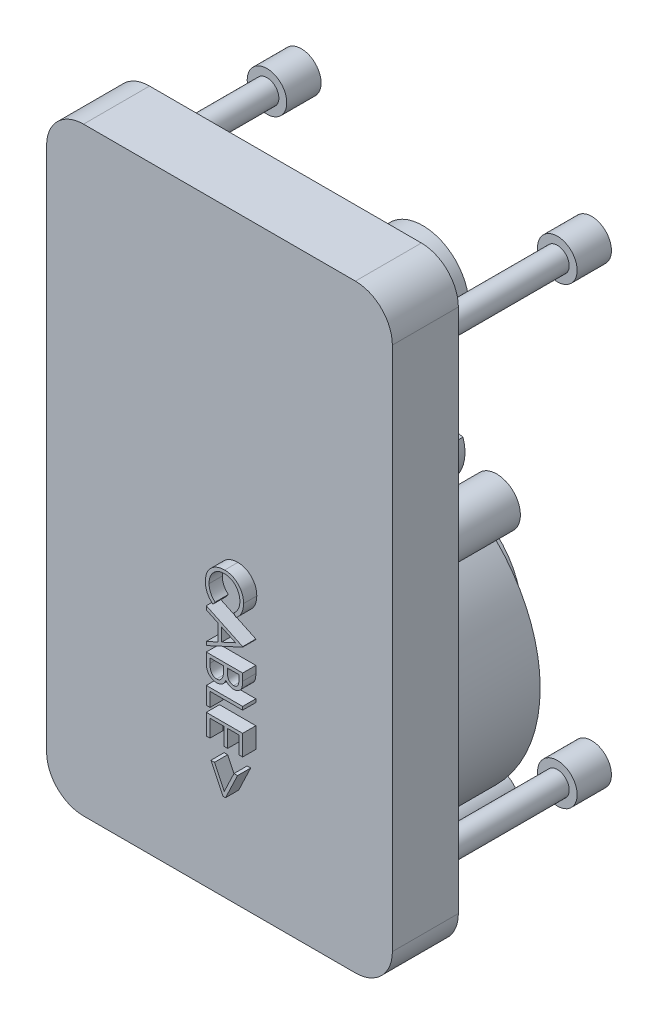
from build123d import *
from build123d.topology import SkipClean

# Parameters (mm, degrees)
SKETCH1_R             = 7.239
BOSS_EXTRUDE1_DEPTH   = 10.16
SKETCH2_R             = 6.35
BOSS_EXTRUDE2_DEPTH   = 1.778
SKETCH3_R             = 2.286
BOSS_EXTRUDE3_DEPTH   = 1.27
BOSS_EXTRUDE4_DEPTH   = 3.302
SKETCH5_R             = 4.445
BOSS_EXTRUDE5_DEPTH   = 11.43
SKETCH6_R             = 1.143
BOSS_EXTRUDE6_DEPTH   = 15.494
BOSS_EXTRUDE6_2_DEPTH = 15.494
BOSS_EXTRUDE6_3_DEPTH = 15.494
BOSS_EXTRUDE6_4_DEPTH = 15.494
SKETCH7_R             = 7.239
BOSS_EXTRUDE7_DEPTH   = 5.334
BOSS_EXTRUDE8_DEPTH   = 6.35
SKETCH9_R             = 1.905
BOSS_EXTRUDE9_DEPTH   = 3.302
BOSS_EXTRUDE10_DEPTH  = 1.27


with BuildPart() as part:
    # Sketch1 → Boss-Extrude1 (new body)
    # profile 1 of 7: a face of its own
    with BuildSketch(Plane.XY):
        with BuildLine():
            ThreePointArc((10.064128852, -22.930567504), (13.235964532, -18.24620987), (14.351, -12.7))
            ThreePointArc((14.351, -12.7), (13.235964532, -7.15379013), (10.064128852, -2.469432496))
            ThreePointArc((10.064128852, -2.469432496), (8.455209632, -1.104283934), (6.663505747, 0.010188518))
            ThreePointArc((6.663505747, 0.010188518), (5.175517983, 0.685261096), (3.62043784, 1.186815))
            ThreePointArc((3.62043784, 1.186815), (0, -3.81), (-3.62043784, 1.186815))
            ThreePointArc((-3.62043784, 1.186815), (-5.175517983, 0.685261096), (-6.663505747, 0.010188518))
            ThreePointArc((-6.663505747, 0.010188518), (-8.455209632, -1.104283934), (-10.064128852, -2.469432496))
            ThreePointArc((-10.064128852, -2.469432496), (-14.351, -12.7), (-10.064128852, -22.930567504))
            ThreePointArc((-10.064128852, -22.930567504), (-8.455209632, -24.295716066), (-6.663505747, -25.410188518))
            ThreePointArc((-6.663505747, -25.410188518), (0, -27.051), (6.663505747, -25.410188518))
            ThreePointArc((6.663505747, -25.410188518), (8.455209632, -24.295716066), (10.064128852, -22.930567504))
        make_face()
        with Locations((0, -12.7)):
            Circle(SKETCH1_R, mode=Mode.SUBTRACT)
    # profile 2 of 7: a face of its own
    with BuildSketch(Plane.XY):
        with BuildLine():
            ThreePointArc((-10.064128852, -2.469432496), (-8.455209632, -1.104283934), (-6.663505747, 0.010188518))
            ThreePointArc((-6.663505747, 0.010188518), (-10.236847552, 1.339105214), (-10.064128852, -2.469432496))
        make_face()
    # profile 3 of 7: a face of its own
    with BuildSketch(Plane.XY):
        with BuildLine():
            ThreePointArc((-3.62043784, 1.186815), (0, -3.81), (3.62043784, 1.186815))
            ThreePointArc((3.62043784, 1.186815), (0, 1.651), (-3.62043784, 1.186815))
        make_face()
    # profile 4 of 7: a face of its own
    with BuildSketch(Plane.XY):
        with BuildLine():
            ThreePointArc((6.663505747, 0.010188518), (8.455209632, -1.104283934), (10.064128852, -2.469432496))
            ThreePointArc((10.064128852, -2.469432496), (10.236847552, 1.339105214), (6.663505747, 0.010188518))
        make_face()
    # profile 5 of 7: a face of its own
    with BuildSketch(Plane.XY):
        with BuildLine():
            ThreePointArc((6.663505747, -25.410188518), (10.236847552, -26.739105214), (10.064128852, -22.930567504))
            ThreePointArc((10.064128852, -22.930567504), (8.455209632, -24.295716066), (6.663505747, -25.410188518))
        make_face()
    # profile 6 of 7: a face of its own
    with BuildSketch(Plane.XY):
        with BuildLine():
            ThreePointArc((-10.064128852, -22.930567504), (-10.236847552, -26.739105214), (-6.663505747, -25.410188518))
            ThreePointArc((-6.663505747, -25.410188518), (-8.455209632, -24.295716066), (-10.064128852, -22.930567504))
        make_face()
    # profile 7 of 7: a face of its own
    with BuildSketch(Plane.XY):
        with Locations((0, -12.7)):
            Circle(SKETCH1_R)
    extrude(amount=-BOSS_EXTRUDE1_DEPTH)

    # Sketch3 → Boss-Extrude3 (add)
    with SkipClean():  # the faces are left unmerged after this step: merging them gives an invalid solid
        with BuildSketch(Plane(origin=(0, 0, -10.16), x_dir=(-1, 0, 0), z_dir=(0, 0, -1))):
            with Locations(Location((-8.89, -0.508, 0), (0, 0, 239.094930529))):
                Circle(SKETCH3_R)
            with Locations(Location((8.89, -24.892, 0), (0, 0, 193.101637405))):
                Circle(SKETCH3_R)
            with Locations(Location((-8.89, -24.892, 0), (0, 0, 120.905069471))):
                Circle(SKETCH3_R)
            with Locations(Location((8.89, -0.508, 0), (0, 0, 166.898362595))):
                Circle(SKETCH3_R)
        extrude(amount=BOSS_EXTRUDE3_DEPTH)

    # Sketch4 → Boss-Extrude4 (add)
    with SkipClean():  # the faces are left unmerged after this step: merging them gives an invalid solid
        with BuildSketch(Plane(origin=(0, 0, -10.16), x_dir=(-1, 0, 0), z_dir=(0, 0, -1))):
            with BuildLine():
                ThreePointArc((-3.62043784, 1.186815), (0, -3.81), (3.62043784, 1.186815))
                ThreePointArc((3.62043784, 1.186815), (0, 1.651), (-3.62043784, 1.186815))
            make_face()
        extrude(amount=BOSS_EXTRUDE4_DEPTH)

    # Sketch7 → Boss-Extrude7 (add)
    with SkipClean():  # the faces are left unmerged after this step: merging them gives an invalid solid
        with BuildSketch(Plane(origin=(0, 0, -10.16), x_dir=(-1, 0, 0), z_dir=(0, 0, -1))):
            with Locations(Location((0, -12.7, 0), (0, 0, 180))):
                Circle(SKETCH7_R)
        extrude(amount=BOSS_EXTRUDE7_DEPTH)



with BuildPart() as body_2:
    # Sketch2 → Boss-Extrude2 (new body)
    with BuildSketch(Plane.XY):
        with Locations((0, 14.605)):
            Circle(SKETCH2_R)
    extrude(amount=-BOSS_EXTRUDE2_DEPTH)

    # Sketch5 → Boss-Extrude5 (add)
    with BuildSketch(Plane(origin=(0, 0, -1.778), x_dir=(-1, 0, 0), z_dir=(0, 0, -1))):
        with Locations(Location((0, 12.7, 0), (0, 0, 269.999298311))):
            Circle(SKETCH5_R)
    extrude(amount=BOSS_EXTRUDE5_DEPTH)


with BuildPart() as body_3:
    # Sketch6 → Boss-Extrude6 (new body)
    with BuildSketch(Plane.XY):
        with Locations((-13.97, 21.844)):
            Circle(SKETCH6_R)
    extrude(amount=-BOSS_EXTRUDE6_DEPTH)


with BuildPart() as body_4:
    # Sketch6 → Boss-Extrude6 2 (new body)
    with BuildSketch(Plane.XY):
        with Locations((13.97, 21.844)):
            Circle(SKETCH6_R)
    extrude(amount=-BOSS_EXTRUDE6_2_DEPTH)


with BuildPart() as body_5:
    # Sketch6 → Boss-Extrude6 3 (new body)
    with BuildSketch(Plane.XY):
        with Locations((-13.97, -21.844)):
            Circle(SKETCH6_R)
    extrude(amount=-BOSS_EXTRUDE6_3_DEPTH)


with BuildPart() as body_6:
    # Sketch6 → Boss-Extrude6 4 (new body)
    with BuildSketch(Plane.XY):
        with Locations((13.97, -21.844)):
            Circle(SKETCH6_R)
    extrude(amount=-BOSS_EXTRUDE6_4_DEPTH)


with BuildPart() as part_1:
    with SkipClean():  # the faces are left unmerged after this step: merging them gives an invalid solid
        add(part.part)

        add(body_2.part)  # Boss-Extrude8 merges body 2

        add(body_3.part)  # Boss-Extrude8 merges body 3

        add(body_4.part)  # Boss-Extrude8 merges body 4

        add(body_5.part)  # Boss-Extrude8 merges body 5

        add(body_6.part)  # Boss-Extrude8 merges body 6
        # Sketch8 → Boss-Extrude8 (add)
        with BuildSketch(Plane.XY):
            with BuildLine():
                Line((-13.081, 28.829), (13.081, 28.829))
                ThreePointArc((13.081, 28.829), (15.595471714, 27.787471714), (16.637, 25.273))
                Line((16.637, 25.273), (16.637, -25.273))
                ThreePointArc((16.637, -25.273), (15.595471714, -27.787471714), (13.081, -28.829))
                Line((13.081, -28.829), (-13.081, -28.829))
                ThreePointArc((-13.081, -28.829), (-15.595471714, -27.787471714), (-16.637, -25.273))
                Line((-16.637, -25.273), (-16.637, 25.273))
                ThreePointArc((-16.637, 25.273), (-15.595471714, 27.787471714), (-13.081, 28.829))
            make_face()
        extrude(amount=BOSS_EXTRUDE8_DEPTH)

    # Sketch9 → Boss-Extrude9 (add)
    with SkipClean():  # the faces are left unmerged after this step: merging them gives an invalid solid
        with BuildSketch(Plane(origin=(0, 0, -15.494), x_dir=(-1, 0, 0), z_dir=(0, 0, -1))):
            with Locations((-13.97, 21.844)):
                Circle(SKETCH9_R)
            with Locations((13.97, 21.844)):
                Circle(SKETCH9_R)
            with Locations((13.97, -21.844)):
                Circle(SKETCH9_R)
            with Locations((-13.97, -21.844)):
                Circle(SKETCH9_R)
        extrude(amount=-BOSS_EXTRUDE9_DEPTH)

    # Sketch10 → Boss-Extrude10 (add)
    # profile 1 of 6: a face of its own
    with SkipClean():  # the faces are left unmerged after this step: merging them gives an invalid solid
        with BuildSketch(Plane.XY.offset(6.35)):
            with BuildLine():
                Line((2.857772436, -3.679487179), (2.647435897, -3.404647436))
                add(Edge.make_bspline(
                    [(2.647435897, -3.404647436), (2.670801867, -3.385041548), (2.717218783, -3.346094101), (2.782398327, -3.283434898), (2.843463589, -3.218133255), (2.900705469, -3.150214134), (2.952122234, -3.078455015), (3.000393337, -3.004594216), (3.043661075, -2.927396171), (3.096124061, -2.820644436), (3.150870216, -2.680996588), (3.196773448, -2.505201749), (3.225994623, -2.32169065), (3.229159465, -2.196493051), (3.230769231, -2.1328125)],
                    knots=[0, 0, 0, 0, 0.757959112, 1.505699292, 2.245454638, 2.979532153, 3.711538275, 4.438200793, 5.171680507, 5.909471876, 7.393775596, 8.890124382, 10.418191784, 12, 12, 12, 12], degree=3))
                add(Edge.make_bspline(
                    [(3.230769231, -2.1328125), (3.230363445, -2.097729627), (3.229555641, -2.027889483), (3.218973416, -1.924234716), (3.20392868, -1.822319184), (3.1821483, -1.722521872), (3.153792222, -1.625040935), (3.120538112, -1.529134135), (3.079156746, -1.435930999), (3.033456552, -1.34430985), (2.981823731, -1.256534692), (2.925523467, -1.173466714), (2.865108338, -1.095485416), (2.800734294, -1.02237471), (2.731601295, -0.954936411), (2.658522608, -0.892089722), (2.580618642, -0.834967287), (2.499350418, -0.782165421), (2.41459849, -0.735181205), (2.326896016, -0.694608059), (2.236578315, -0.6598335), (2.143460367, -0.632062149), (2.047908611, -0.610157149), (1.949720267, -0.59502418), (1.849085923, -0.584537152), (1.780876701, -0.583736779), (1.746494391, -0.583333333)],
                    knots=[0, 0, 0, 0, 1.055000685, 2.100209969, 3.131349012, 4.153242145, 5.170189196, 6.184191144, 7.204341339, 8.235672124, 9.263040994, 10.265373269, 11.252624173, 12.22887325, 13.193405896, 14.155809299, 15.126090485, 16.097288279, 17.069732292, 18.038585918, 19.002221264, 19.978698174, 20.959418239, 21.948869816, 22.966084182, 24, 24, 24, 24], degree=3))
                add(Edge.make_bspline(
                    [(1.746494391, -0.583333333), (1.694763071, -0.584595152), (1.593195486, -0.587072567), (1.444424876, -0.609120901), (1.301904202, -0.642625992), (1.16652436, -0.692841569), (1.036616002, -0.75476062), (0.914377148, -0.833001231), (0.797960584, -0.923617768), (0.690117636, -1.027892188), (0.591603911, -1.142298004), (0.504853329, -1.265045915), (0.432538447, -1.395830203), (0.3723625, -1.533206833), (0.326105772, -1.678232947), (0.293541649, -1.83064775), (0.272299468, -1.990119745), (0.27026578, -2.099089145), (0.269230769, -2.154547276)],
                    knots=[0, 0, 0, 0, 1.029171465, 2.020641659, 2.987623507, 3.938342917, 4.889210282, 5.84687017, 6.821220943, 7.821438502, 8.827599549, 9.822697543, 10.807740252, 11.797342354, 12.80366471, 13.83203677, 14.896651826, 16, 16, 16, 16], degree=3))
                add(Edge.make_bspline(
                    [(0.269230769, -2.154547276), (0.270919549, -2.215649965), (0.274243472, -2.335914674), (0.302402721, -2.5122827), (0.348060638, -2.681118466), (0.411958561, -2.842431052), (0.495023849, -2.995765698), (0.595721726, -3.141362359), (0.715010059, -3.279343929), (0.806093187, -3.362315211), (0.852564103, -3.404647436)],
                    knots=[0, 0, 0, 0, 1.028121516, 2.023589091, 2.998037872, 3.967518031, 4.937445131, 5.927275754, 6.942489185, 8, 8, 8, 8], degree=3))
                Line((0.852564103, -3.404647436), (0.644330929, -3.679487179))
                add(Edge.make_bspline(
                    [(0.644330929, -3.679487179), (0.615792429, -3.657369099), (0.558852125, -3.613238882), (0.478581139, -3.54178043), (0.403074401, -3.466504759), (0.332956835, -3.386842997), (0.266764666, -3.303747898), (0.206716932, -3.215755784), (0.150984484, -3.12438645), (0.100628049, -3.02910793), (0.05547798, -2.930233036), (0.017361042, -2.827864665), (-0.015946051, -2.722870088), (-0.04316627, -2.615196429), (-0.064445988, -2.50448398), (-0.078663293, -2.391112597), (-0.088405847, -2.274842967), (-0.089293675, -2.196401513), (-0.08974359, -2.156650641)],
                    knots=[0, 0, 0, 0, 0.986756325, 1.968786143, 2.935506311, 3.899499537, 4.868307269, 5.8376204, 6.809456583, 7.792545619, 8.781780509, 9.778496008, 10.776623214, 11.79151764, 12.812666265, 13.856269958, 14.913646641, 16, 16, 16, 16], degree=3))
                add(Edge.make_bspline(
                    [(-0.08974359, -2.156650641), (-0.089481597, -2.119006974), (-0.088963539, -2.044571284), (-0.080571372, -1.934672532), (-0.069121635, -1.827682951), (-0.051881504, -1.723908326), (-0.031537164, -1.622782351), (-0.004265907, -1.525221766), (0.026283259, -1.430266556), (0.062188246, -1.338298215), (0.102704429, -1.249238515), (0.148495987, -1.163374704), (0.199177852, -1.080746271), (0.253632863, -1.000540851), (0.313610164, -0.923943267), (0.378276799, -0.850289742), (0.44741481, -0.779167265), (0.497269663, -0.73516458), (0.522335737, -0.713040865)],
                    knots=[0, 0, 0, 0, 1.114604814, 2.203992996, 3.262667896, 4.300477797, 5.318619304, 6.316056647, 7.298880507, 8.271930387, 9.238335007, 10.195173496, 11.151986948, 12.108099108, 13.064862484, 14.031167946, 15.010108607, 16, 16, 16, 16], degree=3))
                add(Edge.make_bspline(
                    [(0.522335737, -0.713040865), (0.565876926, -0.677605222), (0.652433637, -0.607161745), (0.792719618, -0.517036062), (0.939187827, -0.439888506), (1.092607755, -0.377512586), (1.252635143, -0.328749852), (1.419350657, -0.294968657), (1.592598599, -0.273017053), (1.710435388, -0.270506764), (1.770332532, -0.269230769)],
                    knots=[0, 0, 0, 0, 0.994628077, 1.977248131, 2.950237994, 3.925870899, 4.908910175, 5.911660606, 6.938484602, 8, 8, 8, 8], degree=3))
                add(Edge.make_bspline(
                    [(1.770332532, -0.269230769), (1.833285352, -0.270792919), (1.957141094, -0.27386635), (2.138952641, -0.299762866), (2.312890308, -0.341927395), (2.479623367, -0.399988234), (2.638197835, -0.476586004), (2.789283438, -0.569313798), (2.93275681, -0.679077345), (3.066783632, -0.804498118), (3.18931972, -0.9420727), (3.297126777, -1.089389619), (3.386844068, -1.246172066), (3.461840291, -1.410689784), (3.519484737, -1.584175502), (3.559837929, -1.766258861), (3.584955044, -1.956597778), (3.588130252, -2.086460203), (3.58974359, -2.15244391)],
                    knots=[0, 0, 0, 0, 1.032901378, 2.032168977, 3.007206631, 3.966850309, 4.924221947, 5.891988639, 6.871730993, 7.884084801, 8.900290346, 9.89161143, 10.874607481, 11.860025555, 12.854717796, 13.869097222, 14.917278314, 16, 16, 16, 16], degree=3))
                add(Edge.make_bspline(
                    [(3.58974359, -2.15244391), (3.589261812, -2.192658461), (3.588308181, -2.272259114), (3.578996816, -2.390010625), (3.563502411, -2.50465715), (3.542274027, -2.616475949), (3.516255146, -2.725872498), (3.482194419, -2.83172447), (3.442641565, -2.934608269), (3.39824916, -3.03460095), (3.347498469, -3.130614623), (3.292377899, -3.222631813), (3.231615083, -3.309542503), (3.167218841, -3.392981488), (3.096780331, -3.471070292), (3.022593437, -3.546039113), (2.942456775, -3.615298244), (2.886052222, -3.658051701), (2.857772436, -3.679487179)],
                    knots=[0, 0, 0, 0, 1.096705196, 2.170817488, 3.219277236, 4.250701065, 5.274195539, 6.284202015, 7.28098643, 8.279664616, 9.266225751, 10.241373748, 11.203306326, 12.157093976, 13.114198862, 14.069774147, 15.032234603, 16, 16, 16, 16], degree=3))
            make_face()
        # profile 2 of 6: a face of its own
        with BuildSketch(Plane.XY.offset(6.35)):
            Polygon((3.5, -5.833333333), (0, -7.448717949), (0, -7.107271635), (1.121794872, -6.58984375), (1.121794872, -5.003205128), (0, -4.471053686), (0, -4.128205128), (3.5, -5.788461538), align=None)
            Polygon((2.817808494, -5.807391827), (1.480769231, -5.173577724), (1.480769231, -6.424379006), align=None, mode=Mode.SUBTRACT)
        # profile 3 of 6: a face of its own
        with BuildSketch(Plane.XY.offset(6.35)):
            with BuildLine():
                Line((3.5, -7.987179487), (3.5, -8.670072115))
                add(Edge.make_bspline(
                    [(3.5, -8.670072115), (3.49982425, -8.703500594), (3.499483602, -8.768293304), (3.49420047, -8.862512746), (3.486996801, -8.950761556), (3.475566708, -9.033065329), (3.461774931, -9.109386031), (3.445073115, -9.179953668), (3.425046501, -9.244543841), (3.39320022, -9.321656577), (3.345877051, -9.409577238), (3.275948486, -9.504775631), (3.190416023, -9.58617987), (3.093933368, -9.656366187), (2.987797596, -9.712167307), (2.874538407, -9.752536604), (2.755616665, -9.778094479), (2.673973487, -9.780722914), (2.63271234, -9.782051282)],
                    knots=[0, 0, 0, 0, 1.001505555, 1.941167018, 2.826882275, 3.653841531, 4.429895133, 5.150066043, 5.825578002, 6.45369114, 7.647487171, 8.808567382, 9.977351308, 11.170798116, 12.373658725, 13.556498008, 14.765093433, 16, 16, 16, 16], degree=3))
                add(Edge.make_bspline(
                    [(2.63271234, -9.782051282), (2.594053235, -9.780979192), (2.518084448, -9.778872435), (2.407150679, -9.758040783), (2.301116128, -9.727025424), (2.201287981, -9.682000287), (2.108949247, -9.624084028), (2.02464869, -9.554388494), (1.950429264, -9.471406851), (1.909109541, -9.409135189), (1.888120994, -9.377504006)],
                    knots=[0, 0, 0, 0, 1.044266239, 2.052081639, 3.041743201, 4.026043445, 5.00270663, 5.980942822, 6.97441044, 8, 8, 8, 8], degree=3))
                add(Edge.make_bspline(
                    [(1.888120994, -9.377504006), (1.872867775, -9.417271093), (1.843684588, -9.49335538), (1.791808319, -9.598132695), (1.736021049, -9.688767398), (1.674776106, -9.76535925), (1.607935032, -9.829876034), (1.536836284, -9.887813444), (1.45797957, -9.936352004), (1.37361028, -9.978050718), (1.284320561, -10.010867169), (1.190518767, -10.034086961), (1.093253774, -10.048354394), (1.026957798, -10.050299901), (0.993489583, -10.051282051)],
                    knots=[0, 0, 0, 0, 1.272302504, 2.434229863, 3.488457646, 4.447234501, 5.35599188, 6.26022912, 7.18267843, 8.11661068, 9.06895546, 10.019249207, 11.000057067, 12, 12, 12, 12], degree=3))
                add(Edge.make_bspline(
                    [(0.993489583, -10.051282051), (0.959322905, -10.050304899), (0.892099008, -10.048382324), (0.793341106, -10.034206731), (0.698976329, -10.010181531), (0.60833373, -9.977169594), (0.521926377, -9.933840061), (0.438672091, -9.882245878), (0.36078871, -9.819449219), (0.286424081, -9.749453453), (0.219600708, -9.670175718), (0.160109352, -9.584653658), (0.110959363, -9.491657184), (0.070188246, -9.392628424), (0.038590839, -9.286909331), (0.016654453, -9.174891884), (0.001839273, -9.056551741), (0.000623494, -8.975341406), (0, -8.93369391)],
                    knots=[0, 0, 0, 0, 0.978404568, 1.925038397, 2.85041836, 3.763147166, 4.682162379, 5.614488577, 6.562659439, 7.54271123, 8.535210642, 9.526693784, 10.520907202, 11.541451354, 12.589717429, 13.675358278, 14.807842563, 16, 16, 16, 16], degree=3))
                Line((0, -8.93369391), (0, -7.987179487))
                Line((0, -7.987179487), (3.5, -7.987179487))
            make_face()
            with BuildLine():
                Line((3.141025641, -8.301282051), (2.019230769, -8.301282051))
                Line((2.019230769, -8.301282051), (2.019230769, -8.512319712))
                add(Edge.make_bspline(
                    [(2.019230769, -8.512319712), (2.019627364, -8.543168785), (2.020393667, -8.602775481), (2.022657945, -8.689324772), (2.028720383, -8.769462091), (2.035132411, -8.843463576), (2.045005621, -8.910833237), (2.057087658, -8.97179661), (2.069753809, -9.026901337), (2.091355012, -9.090420305), (2.122955643, -9.162449973), (2.173150423, -9.238748286), (2.231312009, -9.307103551), (2.299660574, -9.364179334), (2.374282065, -9.411276833), (2.455183134, -9.44270766), (2.539205431, -9.465001132), (2.597038901, -9.466956125), (2.626402244, -9.467948718)],
                    knots=[0, 0, 0, 0, 1.156481963, 2.23455883, 3.244418989, 4.168404366, 5.01828131, 5.794834307, 6.498111525, 7.13526334, 8.307595709, 9.435046769, 10.546766856, 11.659452936, 12.760769924, 13.837671619, 14.902137667, 16, 16, 16, 16], degree=3))
                add(Edge.make_bspline(
                    [(2.626402244, -9.467948718), (2.645837164, -9.46745228), (2.683960884, -9.466478463), (2.739322416, -9.457615573), (2.792056229, -9.444755433), (2.84094948, -9.424663971), (2.887391857, -9.40036924), (2.929320542, -9.368766205), (2.969032638, -9.333075662), (3.005070015, -9.291160594), (3.037359647, -9.243223955), (3.06577169, -9.188808998), (3.088183923, -9.12726598), (3.108288888, -9.059990319), (3.122239543, -8.985905328), (3.133904149, -8.905734918), (3.13983359, -8.81879898), (3.140619428, -8.758654053), (3.141025641, -8.727564103)],
                    knots=[0, 0, 0, 0, 0.911752476, 1.788502045, 2.626783689, 3.45400582, 4.26402138, 5.080402872, 5.911472738, 6.767166405, 7.66795952, 8.620018292, 9.640966946, 10.73819047, 11.913090943, 13.176185384, 14.540321519, 16, 16, 16, 16], degree=3))
                Line((3.141025641, -8.727564103), (3.141025641, -8.301282051))
            make_face(mode=Mode.SUBTRACT)
            with BuildLine():
                Line((1.66025641, -8.301282051), (0.358974359, -8.301282051))
                Line((0.358974359, -8.301282051), (0.358974359, -8.748597756))
                add(Edge.make_bspline(
                    [(0.358974359, -8.748597756), (0.359356766, -8.780616841), (0.360093805, -8.842329406), (0.362526199, -8.931428523), (0.367942779, -9.013786891), (0.376773248, -9.089451901), (0.385948875, -9.159089613), (0.398648387, -9.222008173), (0.413086196, -9.278304041), (0.43542939, -9.343572232), (0.470080688, -9.417115598), (0.522667742, -9.496314398), (0.584492161, -9.56743167), (0.656948104, -9.627131057), (0.735135085, -9.676428471), (0.81864416, -9.711003623), (0.904927716, -9.733234951), (0.963909533, -9.735861995), (0.993489583, -9.737179487)],
                    knots=[0, 0, 0, 0, 1.159821618, 2.235403267, 3.228114831, 4.14795534, 4.994323282, 5.771256229, 6.471395042, 7.097801288, 8.267864287, 9.404187171, 10.531774336, 11.667624178, 12.792825787, 13.866573821, 14.930062559, 16, 16, 16, 16], degree=3))
                add(Edge.make_bspline(
                    [(0.993489583, -9.737179487), (1.011985316, -9.736910196), (1.048678445, -9.736375957), (1.102559382, -9.728016016), (1.154984973, -9.716353352), (1.205162465, -9.699464814), (1.253908353, -9.678169735), (1.30037356, -9.651445218), (1.345669087, -9.620583465), (1.402867072, -9.572305486), (1.468791298, -9.502150596), (1.533326389, -9.402438104), (1.585374877, -9.28906742), (1.607474256, -9.206839697), (1.618890224, -9.164362981)],
                    knots=[0, 0, 0, 0, 0.723503378, 1.435336582, 2.130201219, 2.824764462, 3.504949994, 4.209866579, 4.920640069, 5.648298893, 7.13757748, 8.670694625, 10.280166878, 12, 12, 12, 12], degree=3))
                add(Edge.make_bspline(
                    [(1.618890224, -9.164362981), (1.622345541, -9.147333901), (1.629837379, -9.110411343), (1.637740616, -9.050203457), (1.644830077, -8.981237103), (1.64993647, -8.903807058), (1.655418093, -8.81760537), (1.657474037, -8.722659733), (1.659983424, -8.618903025), (1.660163087, -8.546910565), (1.66025641, -8.509515224)],
                    knots=[0, 0, 0, 0, 0.634452549, 1.375623993, 2.216454381, 3.166361212, 4.209414599, 5.370755378, 6.634280627, 8, 8, 8, 8], degree=3))
                Line((1.66025641, -8.509515224), (1.66025641, -8.301282051))
            make_face(mode=Mode.SUBTRACT)
        # profile 4 of 6: a face of its own
        with BuildSketch(Plane.XY.offset(6.35)):
            Polygon((3.5, -10.769230769), (3.5, -11.083333333), (0.358974359, -11.083333333), (0.358974359, -12.429487179), (0, -12.429487179), (0, -10.769230769), align=None)
        # profile 5 of 6: a face of its own
        with BuildSketch(Plane.XY.offset(6.35)):
            Polygon((3.5, -13.012820513), (3.5, -14.987179487), (3.141025641, -14.987179487), (3.141025641, -13.326923077), (2.064102564, -13.326923077), (2.064102564, -14.987179487), (1.705128205, -14.987179487), (1.705128205, -13.326923077), (0.358974359, -13.326923077), (0.358974359, -14.987179487), (0, -14.987179487), (0, -13.012820513), align=None)
        # profile 6 of 6: a face of its own
        with BuildSketch(Plane.XY.offset(6.35)):
            Polygon((0.790164263, -16.782051282), (1.727564103, -18.746594551), (2.664963942, -16.782051282), (3.006410256, -16.782051282), (1.850260417, -19.205128205), (1.604867788, -19.205128205), (0.448717949, -16.782051282), align=None)
        extrude(amount=BOSS_EXTRUDE10_DEPTH)


solid = part_1.part
